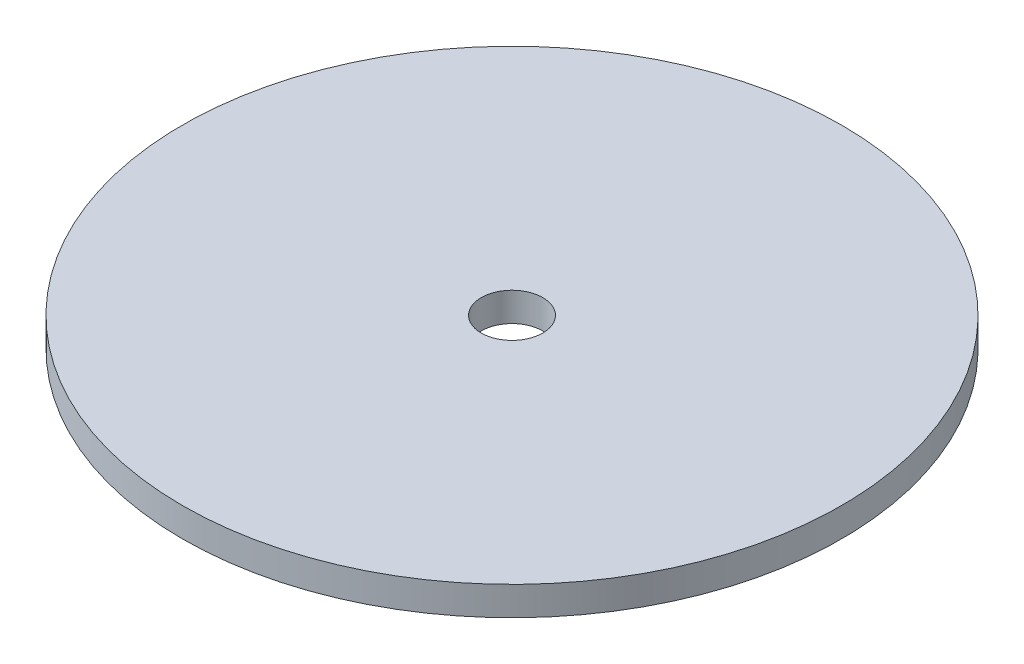
from build123d import *

# Parameters (mm, degrees)
SKETCH1_R                = 36.195
BOSS_EXTRUDE1_DEPTH      = 1.5875
H_0_266_DIAMETER_HOLE2_D = 6.7564


with BuildPart() as part:
    # Sketch1 → Boss-Extrude1 (new, symmetric)
    with BuildSketch(Plane(origin=(0, 0, 0), x_dir=(1, 0, 0), z_dir=(0, 1, 0))):
        Circle(SKETCH1_R)
    extrude(amount=BOSS_EXTRUDE1_DEPTH, both=True)

    # H (0.266) Diameter Hole2 (through all)
    with Locations(Plane(origin=(0, 1.5875, 0), x_dir=(1, 0, 0), z_dir=(0, 1, 0))):
        with Locations((0, 0)):
            Hole(H_0_266_DIAMETER_HOLE2_D / 2)


solid = part.part
